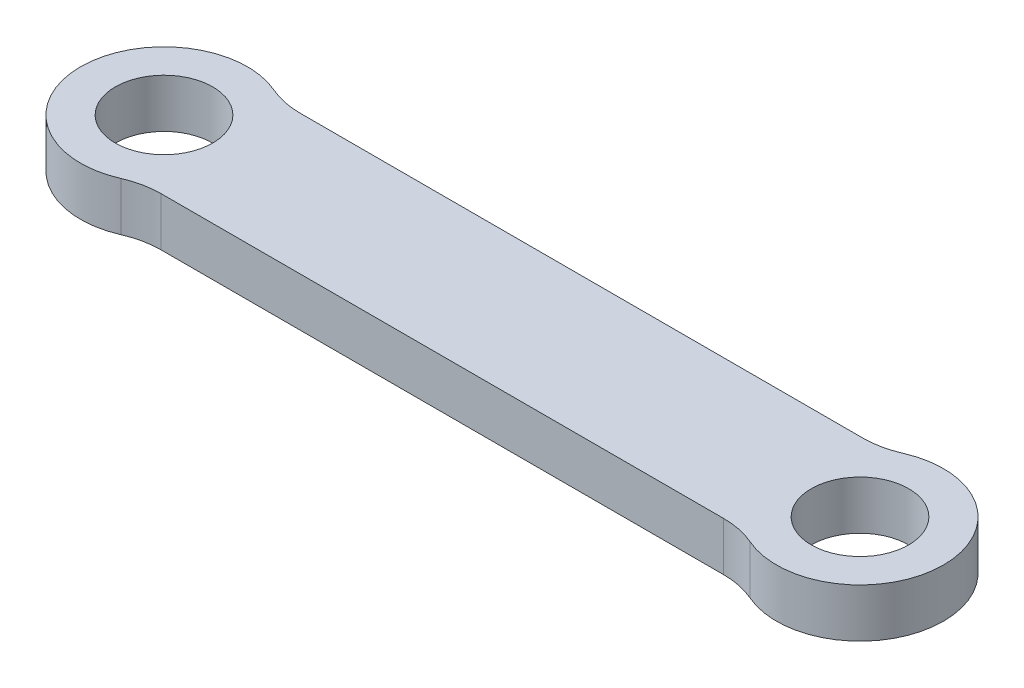
from build123d import *

# Parameters (mm, degrees)
SKETCH1_R           = 1.75
BOSS_EXTRUDE1_DEPTH = 1.75
FILLET1_R           = 3


with BuildPart() as part:
    # Sketch1 → Boss-Extrude1 (new body)
    with BuildSketch(Plane(origin=(0, 0, 0), x_dir=(1, 0, 0), z_dir=(0, 1, 0))):
        with BuildLine():
            ThreePointArc((1.658312395, 2.5), (-3, 0), (1.658312395, -2.5))
            Line((1.658312395, -2.5), (23.341687605, -2.5))
            ThreePointArc((23.341687605, -2.5), (28, 0), (23.341687605, 2.5))
            Line((23.341687605, 2.5), (1.658312395, 2.5))
        make_face()
        with Locations(Location((0, 0, 0), (0, 0, 270))):
            Circle(SKETCH1_R, mode=Mode.SUBTRACT)
        with Locations(Location((25, 0, 0), (0, 0, 270))):
            Circle(SKETCH1_R, mode=Mode.SUBTRACT)
    extrude(amount=BOSS_EXTRUDE1_DEPTH)

    # Fillet1
    fillet1_edges = [part.edges().sort_by_distance(p)[0] for p in [
        (23.341687605, 0.875, 2.5),
        (1.658312395, 0.875, 2.5),
        (1.658312395, 0.875, -2.5),
        (23.341687605, 0.875, -2.5),
    ]]
    fillet(fillet1_edges, radius=FILLET1_R)


solid = part.part
